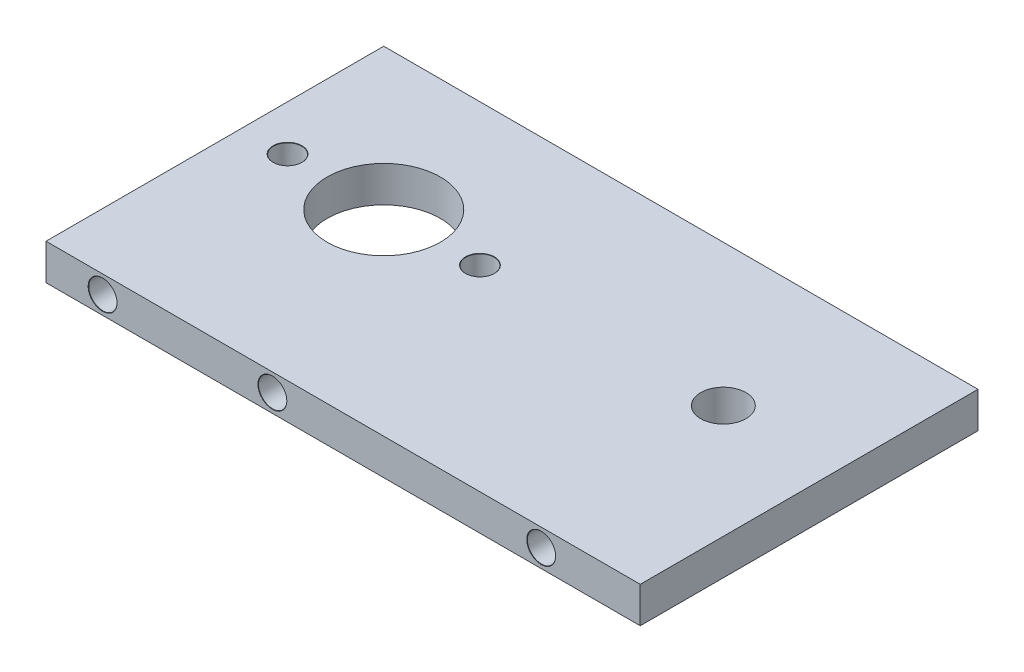
from build123d import *

# Parameters (mm, degrees)
BOSS_EXTRUDE1_DEPTH                   = 3.175
TAP_DRILL_FOR_M3X0_5_TAP1_D           = 2.5
TAP_DRILL_FOR_M3X0_5_TAP1_CSINK_D     = 2.55
TAP_DRILL_FOR_M3X0_5_TAP1_CSINK_ANGLE = 90
CUT_EXTRUDE1_REACH                    = 23.61
SKETCH8_R                             = 5
SKETCH9_W                             = 27.5
SKETCH9_H                             = 29.84
SKETCH9_R                             = 2
BOSS_EXTRUDE2_DEPTH                   = 3.175
TAP_DRILL_FOR_M3X0_5_TAP2_D           = 2.5
TAP_DRILL_FOR_M3X0_5_TAP2_DEPTH       = 12
TAP_DRILL_FOR_M3X0_5_TAP2_CSINK_D     = 2.55
TAP_DRILL_FOR_M3X0_5_TAP2_CSINK_ANGLE = 90
TAP_DRILL_FOR_M3X0_5_TAP2_TIP         = 0.751075774


with BuildPart() as part:
    # Sketch1 → Boss-Extrude1 (new body)
    with BuildSketch(Plane(origin=(0, 0, 0), x_dir=(1, 0, 0), z_dir=(0, 1, 0))):
        Polygon((-12.5, -12.5), (-12.5, -17.34), (12.5, -17.34), (12.5, -12.5), (12.5, 12.5), (-12.5, 12.5), align=None)
    extrude(amount=BOSS_EXTRUDE1_DEPTH)

    # Tap Drill for M3x0.5 Tap1 (through all)
    with Locations(Plane(origin=(0, 3.175, 0), x_dir=(1, 0, 0), z_dir=(0, 1, 0))):
        with Locations((-8.5, 0), (8.5, 0)):
            CounterSinkHole(TAP_DRILL_FOR_M3X0_5_TAP1_D / 2, TAP_DRILL_FOR_M3X0_5_TAP1_CSINK_D / 2, counter_sink_angle=TAP_DRILL_FOR_M3X0_5_TAP1_CSINK_ANGLE)

    # Sketch8 → Cut-Extrude1 (cut, up to next)
    with BuildSketch(Plane(origin=(0, 3.175, 0), x_dir=(1, 0, 0), z_dir=(0, 1, 0)), mode=Mode.PRIVATE) as cut_extrude1_sk1:
        with Locations(Location((0, 0, 0), (0, 0, 270))):
            Circle(SKETCH8_R)
    cut_extrude1_tool1 = extrude(cut_extrude1_sk1.sketch, amount=-CUT_EXTRUDE1_REACH, mode=Mode.PRIVATE) & part.part
    add(cut_extrude1_tool1.solids().sort_by_distance((0, 3.175, 0))[0], mode=Mode.SUBTRACT)

    # Sketch9 → Boss-Extrude2 (add)
    with BuildSketch(Plane(origin=(0, 3.175, 0), x_dir=(1, 0, 0), z_dir=(0, 1, 0))):
        with Locations((26.25, -2.42)):
            Rectangle(SKETCH9_W, SKETCH9_H)
        with Locations(Location((30, 0, 0), (0, 0, 270))):
            Circle(SKETCH9_R, mode=Mode.SUBTRACT)
    extrude(amount=-BOSS_EXTRUDE2_DEPTH)

    # Tap Drill for M3x0.5 Tap2
    with Locations(Plane.XY.offset(17.34)):
        with Locations((-7.5, 1.5875), (7.5, 1.5875), (31.25, 1.5875)):
            CounterSinkHole(TAP_DRILL_FOR_M3X0_5_TAP2_D / 2, TAP_DRILL_FOR_M3X0_5_TAP2_CSINK_D / 2, depth=TAP_DRILL_FOR_M3X0_5_TAP2_DEPTH, counter_sink_angle=TAP_DRILL_FOR_M3X0_5_TAP2_CSINK_ANGLE)
            with Locations((0, 0, -(TAP_DRILL_FOR_M3X0_5_TAP2_DEPTH + TAP_DRILL_FOR_M3X0_5_TAP2_TIP / 2))):  # 118° drill point
                Cone(0, TAP_DRILL_FOR_M3X0_5_TAP2_D / 2, TAP_DRILL_FOR_M3X0_5_TAP2_TIP, mode=Mode.SUBTRACT)


solid = part.part
